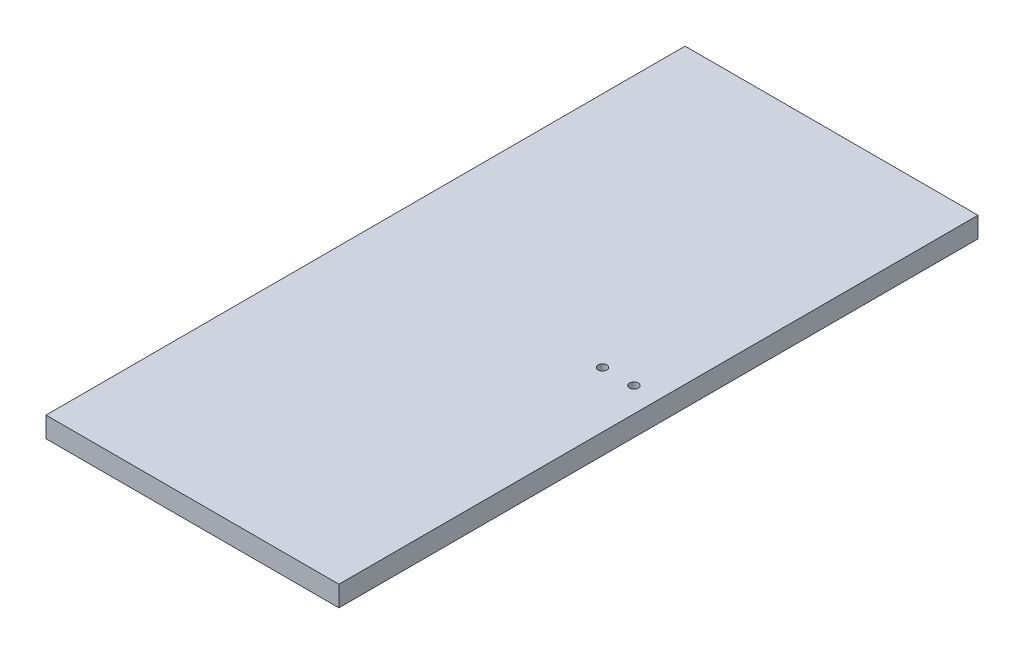
from build123d import *

# Parameters (mm, degrees)
SKETCH1_W           = 139.7
SKETCH1_H           = 9.779
BOSS_EXTRUDE1_DEPTH = 304.8
CUT_EXTRUDE2_DEPTH  = 336.432197085


with BuildPart() as part:
    # Sketch1 → Boss-Extrude1 (new body)
    with BuildSketch(Plane.XY):
        with Locations((69.85, 4.8895)):
            Rectangle(SKETCH1_W, SKETCH1_H)
    extrude(amount=BOSS_EXTRUDE1_DEPTH)

    # Sketch2 → Cut-Extrude2 (cut, through all)
    with BuildSketch(Plane(origin=(0, 9.779, 0), x_dir=(1, 0, 0), z_dir=(0, 1, 0))):
        with BuildLine():
            ThreePointArc((115.115999991, -152.4), (113.016, -150.300000009), (110.916000009, -152.4))
            Line((110.916000009, -152.4), (115.115999991, -152.4))
        make_face()
        with BuildLine():
            Line((115.115999991, -152.4), (110.916000009, -152.4))
            ThreePointArc((110.916000009, -152.4), (113.016, -154.499999991), (115.115999991, -152.4))
        make_face()
        with BuildLine():
            ThreePointArc((130.115999991, -152.4), (128.016, -150.300000009), (125.916000009, -152.4))
            Line((125.916000009, -152.4), (130.115999991, -152.4))
        make_face()
        with BuildLine():
            Line((130.115999991, -152.4), (125.916000009, -152.4))
            ThreePointArc((125.916000009, -152.4), (128.016, -154.499999991), (130.115999991, -152.4))
        make_face()
    extrude(amount=-CUT_EXTRUDE2_DEPTH, mode=Mode.SUBTRACT)


solid = part.part
